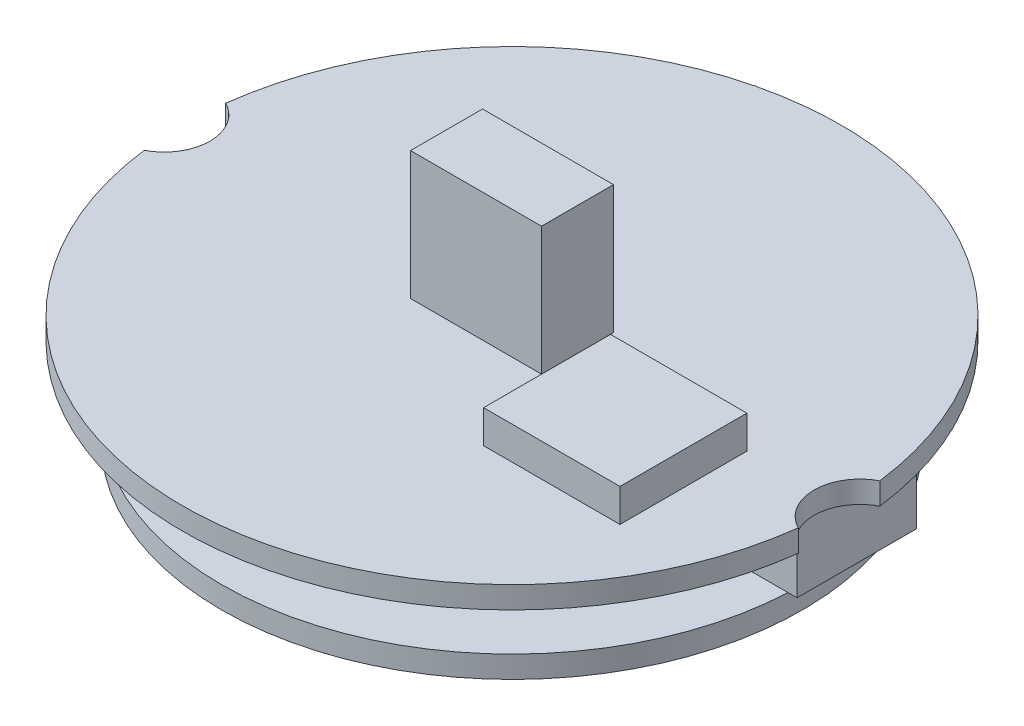
from build123d import *

# Parameters (mm, degrees)
SKETCH1_R           = 7.93026875
BOSS_EXTRUDE1_DEPTH = 0.6
SKETCH2_W           = 16.335240752
SKETCH2_H           = 3.264094219
BOSS_EXTRUDE2_DEPTH = 1.8
BOSS_EXTRUDE3_DEPTH = 0.6
SKETCH4_W           = 3.724930292
SKETCH4_H           = 3.466254577
BOSS_EXTRUDE4_DEPTH = 0.9
SKETCH5_W           = 3.577115598
SKETCH5_H           = 1.965935432
BOSS_EXTRUDE5_DEPTH = 3.5


with BuildPart() as part:
    # Sketch1 → Boss-Extrude1 (new body)
    with BuildSketch(Plane(origin=(0, 0, 0), x_dir=(1, 0, 0), z_dir=(0, 1, 0))):
        with Locations(Location((0, 0, 0), (0, 0, 270))):
            Circle(SKETCH1_R)
    extrude(amount=BOSS_EXTRUDE1_DEPTH)

    # Sketch2 → Boss-Extrude2 (add)
    with BuildSketch(Plane(origin=(0, 0.6, 0), x_dir=(1, 0, 0), z_dir=(0, 1, 0))):
        with Locations((0, 1.248036025)):
            Rectangle(SKETCH2_W, SKETCH2_H)
    extrude(amount=BOSS_EXTRUDE2_DEPTH)


with BuildPart() as body_2:
    # Sketch3 → Boss-Extrude3 (new body)
    with BuildSketch(Plane(origin=(0, 2.4, 0), x_dir=(1, 0, 0), z_dir=(0, 1, 0))):
        with BuildLine():
            ThreePointArc((8.930921053, -1.112946158), (8.25, 0), (8.930921053, 1.112946158))
            ThreePointArc((8.930921053, 1.112946158), (0, 9), (-8.930921053, 1.112946158))
            ThreePointArc((-8.930921053, 1.112946158), (-8.433733456, 0.652361601), (-8.25, 0))
            ThreePointArc((-8.25, 0), (-8.433733456, -0.652361601), (-8.930921053, -1.112946158))
            ThreePointArc((-8.930921053, -1.112946158), (0, -9), (8.930921053, -1.112946158))
        make_face()
    extrude(amount=BOSS_EXTRUDE3_DEPTH)

    # Sketch4 → Boss-Extrude4 (add)
    with BuildSketch(Plane(origin=(0, 3, 0), x_dir=(1, 0, 0), z_dir=(0, 1, 0))):
        with Locations((4.552692579, -1.733127289)):
            Rectangle(SKETCH4_W, SKETCH4_H)
    extrude(amount=BOSS_EXTRUDE4_DEPTH)

    # Sketch5 → Boss-Extrude5 (add)
    with BuildSketch(Plane(origin=(0, 3, 0), x_dir=(1, 0, 0), z_dir=(0, 1, 0))):
        Rectangle(SKETCH5_W, SKETCH5_H)
    extrude(amount=BOSS_EXTRUDE5_DEPTH)


solid = Compound([part.part, body_2.part])
